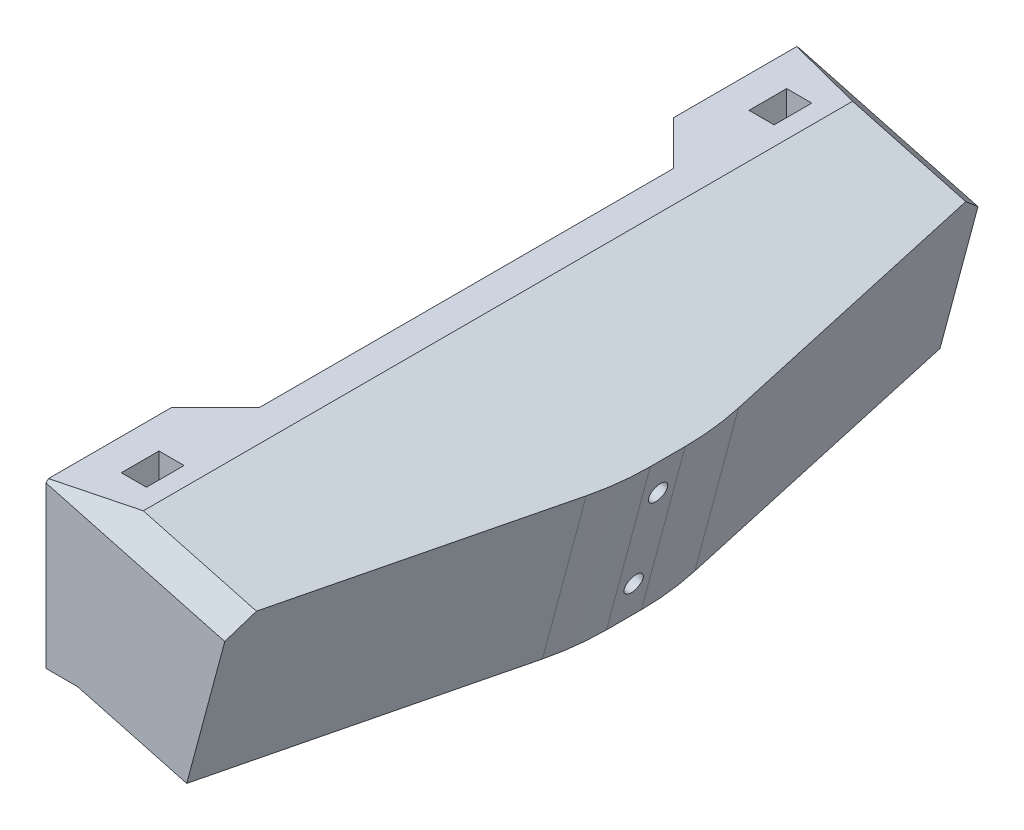
from build123d import *

# Parameters (mm, degrees)
BOSS_EXTRUDE1_DEPTH = 120
BOSS_EXTRUDE2_DEPTH = 26.917180691
CUT_EXTRUDE3_DEPTH  = 131.498822542
SKETCH7_R           = 1.55
CUT_EXTRUDE4_DEPTH  = 10
CUT_EXTRUDE5_DEPTH  = 4
FILLET1_R           = 50
SKETCH10_R          = 1.5
CUT_EXTRUDE6_DEPTH  = 129.833895271
CHAMFER4_SIZE       = 3.5
SKETCH12_R          = 4
CUT_EXTRUDE8_DEPTH  = 5
SKETCH12_3_R        = 4
CUT_EXTRUDE9_DEPTH  = 9


with BuildPart() as part:
    # Sketch1 → Boss-Extrude1 (new body)
    with BuildSketch(Plane.XY):
        Polygon((12, 26), (5.033320997, 0), (22.41998587, -4.658742812), (29.386664873, 21.341257188), align=None)
        Polygon((0, 0), (0, 26), (12, 26), (5.033320997, 0), align=None)
    extrude(amount=-BOSS_EXTRUDE1_DEPTH)

    # Sketch3 → Boss-Extrude2 (add)
    with BuildSketch(Plane(origin=(7.303847577, 27.258330249, 0), x_dir=(0.9659258262890693, -0.2588190451025172, 0), z_dir=(0.2588190451025172, 0.9659258262890693, 0))):
        Polygon((22.861814743, 0), (32.861814743, 52.5), (32.861814743, 67.5), (22.861814743, 120), align=None)
    extrude(amount=-BOSS_EXTRUDE2_DEPTH)

    # Sketch6 → Cut-Extrude3 (cut, through all)
    with BuildSketch(Plane(origin=(0, 26, 0), x_dir=(1, 0, 0), z_dir=(0, 1, 0))):
        Polygon((0, 100), (7, 93), (7, 27), (0, 20), align=None)
    extrude(amount=-CUT_EXTRUDE3_DEPTH, mode=Mode.SUBTRACT)

    # Sketch7 → Cut-Extrude4 (cut)
    with BuildSketch(Plane.ZY):
        with Locations((-110, 15)):
            Circle(SKETCH7_R)
        with Locations((-10, 15)):
            Circle(SKETCH7_R)
    extrude(amount=-CUT_EXTRUDE4_DEPTH, mode=Mode.SUBTRACT)

    # Sketch8 → Cut-Extrude5 (cut)
    with BuildSketch(Plane.ZY.offset(-5)):
        Polygon((-113, 16.732050808), (-113, 26), (-107, 26), (-107, 16.732050808), (-107, 13.267949192), (-110, 11.535898385), (-113, 13.267949192), align=None)
        Polygon((-13, 26), (-13, 16.732050808), (-13, 13.267949192), (-10, 11.535898385), (-7, 13.267949192), (-7, 16.732050808), (-7, 26), align=None)
    extrude(amount=-CUT_EXTRUDE5_DEPTH, mode=Mode.SUBTRACT)

    # Fillet1
    fillet1_edges = [part.edges().sort_by_distance(p)[0] for p in [
        (35.562583634, 5.753066737, -52.5),
        (35.562583634, 5.753066737, -67.5),
    ]]
    fillet(fillet1_edges, radius=FILLET1_R)

    # Sketch10 → Cut-Extrude6 (cut, through all)
    with BuildSketch(Plane(origin=(31.742075559, -8.505263512, 0), x_dir=(0, 0, -1), z_dir=(0.9659258262890693, -0.25881904510251724, 0))):
        with Locations(Location((60, 22.261309679, 0), (0, 0, 90))):
            Circle(SKETCH10_R)
        with Locations(Location((60, 7.261309679, 0), (0, 0, 90))):
            Circle(SKETCH10_R)
    extrude(amount=-CUT_EXTRUDE6_DEPTH, mode=Mode.SUBTRACT)

    # Chamfer4
    chamfer4_edges = [part.edges().sort_by_distance(p)[0] for p in [
        (20.693332437, 23.670628594, -120),
        (20.693332437, 23.670628594, 0),
    ]]
    chamfer(chamfer4_edges, length=CHAMFER4_SIZE)

    # Sketch12 → Cut-Extrude8 (cut)
    with BuildSketch(Plane(origin=(-2.065328361, 0.553403067, 0), x_dir=(0, 0, -1), z_dir=(0.9659258262890693, -0.25881904510251724, 0))):
        with Locations(Location((60, 22.261309679, 0), (0, 0, 90))):
            Circle(SKETCH12_R)
    extrude(amount=CUT_EXTRUDE8_DEPTH, mode=Mode.SUBTRACT)

    # Sketch12<3> → Cut-Extrude9 (cut)
    with BuildSketch(Plane(origin=(-2.065328361, 0.553403067, 0), x_dir=(0, 0, -1), z_dir=(0.9659258262890693, -0.25881904510251724, 0))):
        with Locations(Location((60, 7.261309679, 0), (0, 0, 90))):
            Circle(SKETCH12_3_R)
    extrude(amount=CUT_EXTRUDE9_DEPTH, mode=Mode.SUBTRACT)


solid = part.part
